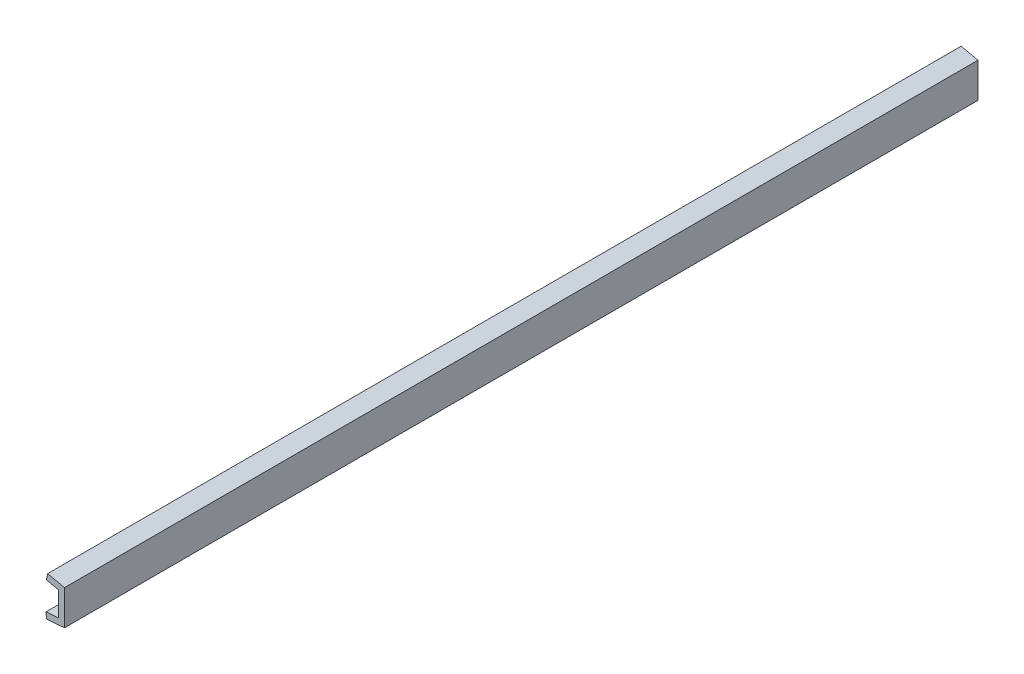
from build123d import *

# Parameters (mm, degrees)
BOSS_EXTRUDE1_DEPTH = 750


with BuildPart() as part:
    # Master sketch-Wing Geometry Master Sketc → Boss-Extrude1 (new body)
    with BuildSketch(Plane.XY):
        with BuildLine():
            Line((224.93, -6.178926254), (224.93, 22.373189537))
            add(Edge.make_bspline(
                [(224.93, 22.373189537), (223.937151031, 22.604229635), (221.53569088, 23.158078559), (217.696277573, 24.019984904), (214.083050592, 24.807059628), (211.880072571, 25.27832033), (211.114806417, 25.441064095)],
                knots=[0.125197771, 0.125197771, 0.125197771, 0.125197771, 0.130088746, 0.137022467, 0.144077656, 0.147831525, 0.147831525, 0.147831525, 0.147831525], degree=3))
            Line((211.114806417, 25.441064095), (210.07475011, 20.55043194))
            Line((210.07475011, 20.55043194), (219.93, 18.391622486))
            Line((219.93, 18.391622486), (219.93, -1.558186688))
            Line((219.93, -1.558186688), (209.78690169, -2.365451127))
            Line((209.78690169, -2.365451127), (210.173597999, -7.350571372))
            add(Edge.make_bspline(
                [(210.173597999, -7.350571372), (210.519069964, -7.323773075), (212.294721257, -7.18589941), (215.480211959, -6.932652125), (219.709739235, -6.590064586), (222.853288837, -6.342418671), (224.586664849, -6.205927526), (224.93, -6.178926254)],
                knots=[0.856037867, 0.856037867, 0.856037867, 0.856037867, 0.857700425, 0.864583105, 0.871370128, 0.878060224, 0.879712638, 0.879712638, 0.879712638, 0.879712638], degree=3))
        make_face()
    extrude(amount=BOSS_EXTRUDE1_DEPTH)


solid = part.part
